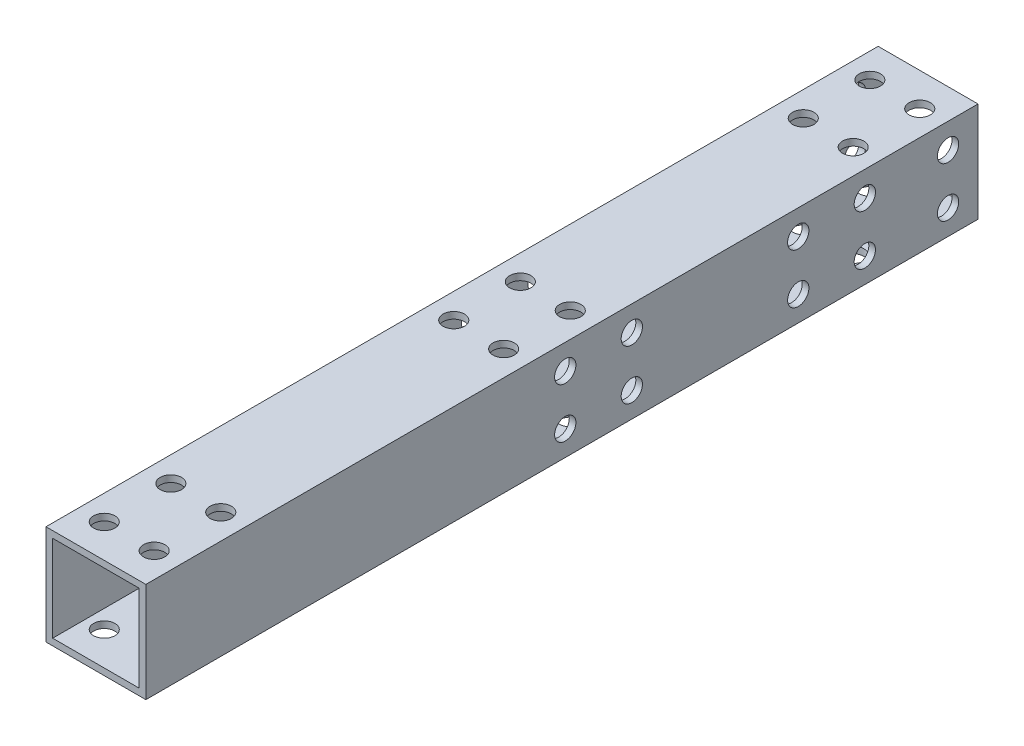
from build123d import *

# Parameters (mm, degrees)
SKETCH_1_W          = 15
SKETCH_1_H          = 15
SKETCH_1_W_2        = 13
SKETCH_1_H_2        = 13
EXTRUDE_1_DEPTH     = 125
SKETCH_2_R          = 1.6
CUT_EXTRUDE_1_DEPTH = 127.787223331
SKETCH_3_R          = 1.6
CUT_EXTRUDE_2_DEPTH = 127.787223331


with BuildPart() as part:
    # 草图1 → 拉伸-薄壁1 (new body)
    with BuildSketch(Plane.XY):
        with Locations((7.5, -7.5)):
            Rectangle(SKETCH_1_W, SKETCH_1_H)
        with Locations((7.5, -7.5)):
            Rectangle(SKETCH_1_W_2, SKETCH_1_H_2, mode=Mode.SUBTRACT)
    extrude(amount=EXTRUDE_1_DEPTH)

    # 草图2 → 切除-拉伸1 (cut, through all)
    with BuildSketch(Plane(origin=(15, 0, 0), x_dir=(0, 0, -1), z_dir=(1, 0, 0))):
        with Locations((-62, -3.75)):
            Circle(SKETCH_2_R)
        with Locations((-62, -11.25)):
            Circle(SKETCH_2_R)
        with Locations((-52, -11.25)):
            Circle(SKETCH_2_R)
        with Locations((-52, -3.75)):
            Circle(SKETCH_2_R)
        with Locations((-17, -3.75)):
            Circle(SKETCH_2_R)
        with Locations((-17, -11.25)):
            Circle(SKETCH_2_R)
        with Locations((-27, -11.25)):
            Circle(SKETCH_2_R)
        with Locations((-27, -3.75)):
            Circle(SKETCH_2_R)
        with Locations((-4.5, -3.75)):
            Circle(SKETCH_2_R)
        with Locations((-4.5, -11.25)):
            Circle(SKETCH_2_R)
    extrude(amount=-CUT_EXTRUDE_1_DEPTH, mode=Mode.SUBTRACT)

    # 草图3 → 切除-拉伸2 (cut, through all)
    with BuildSketch(Plane(origin=(0, 0, 0), x_dir=(1, 0, 0), z_dir=(0, 1, 0))):
        with Locations(Location((3.75, -5, 0), (0, 0, 270))):
            Circle(SKETCH_3_R)
        with Locations(Location((11.25, -5, 0), (0, 0, 90))):
            Circle(SKETCH_3_R)
        with Locations(Location((11.25, -15, 0), (0, 0, 270))):
            Circle(SKETCH_3_R)
        with Locations(Location((3.75, -15, 0), (0, 0, 90))):
            Circle(SKETCH_3_R)
        with Locations(Location((3.75, -57.5, 0), (0, 0, 270))):
            Circle(SKETCH_3_R)
        with Locations(Location((11.25, -57.5, 0), (0, 0, 90))):
            Circle(SKETCH_3_R)
        with Locations(Location((11.25, -67.5, 0), (0, 0, 270))):
            Circle(SKETCH_3_R)
        with Locations(Location((3.75, -67.5, 0), (0, 0, 90))):
            Circle(SKETCH_3_R)
        with Locations(Location((3.75, -110, 0), (0, 0, 270))):
            Circle(SKETCH_3_R)
        with Locations(Location((11.25, -110, 0), (0, 0, 90))):
            Circle(SKETCH_3_R)
        with Locations(Location((11.25, -120, 0), (0, 0, 270))):
            Circle(SKETCH_3_R)
        with Locations(Location((3.75, -120, 0), (0, 0, 90))):
            Circle(SKETCH_3_R)
    extrude(amount=-CUT_EXTRUDE_2_DEPTH, mode=Mode.SUBTRACT)


solid = part.part
